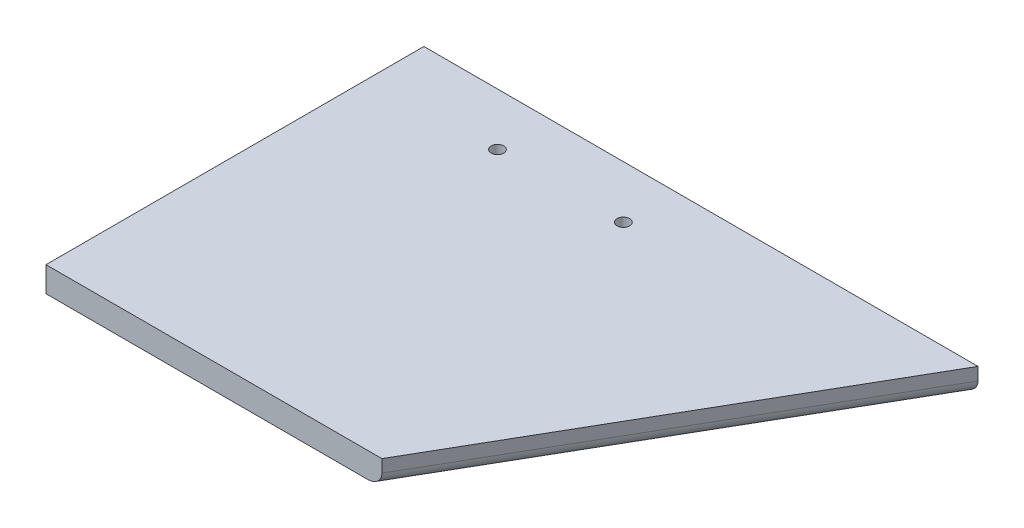
from build123d import *

# Parameters (mm, degrees)
BOSS_EXTRUDE1_DEPTH = 6
FILLET1_R           = 3
SKETCH2_R           = 1.5
CUT_EXTRUDE1_DEPTH  = 121.565334985


with BuildPart() as part:
    # Sketch1 → Boss-Extrude1 (new body)
    with BuildSketch(Plane(origin=(0, 0, 0), x_dir=(1, 0, 0), z_dir=(0, 1, 0))):
        Polygon((0, 0), (51.961524227, 90), (0, 90), (-80, 90), (-80, 0), align=None)
    extrude(amount=BOSS_EXTRUDE1_DEPTH)

    # Fillet1
    fillet1_edges = [part.edges().sort_by_distance(p)[0] for p in [
        (25.980762114, 0, -45),
    ]]
    fillet(fillet1_edges, radius=FILLET1_R)

    # Sketch2 → Cut-Extrude1 (cut, through all)
    with BuildSketch(Plane(origin=(0, 6, 0), x_dir=(1, 0, 0), z_dir=(0, 1, 0))):
        with Locations(Location((-50, 77.5, 0), (0, 0, 270))):
            Circle(SKETCH2_R)
        with Locations(Location((-20, 77.5, 0), (0, 0, 270))):
            Circle(SKETCH2_R)
    extrude(amount=-CUT_EXTRUDE1_DEPTH, mode=Mode.SUBTRACT)


solid = part.part
